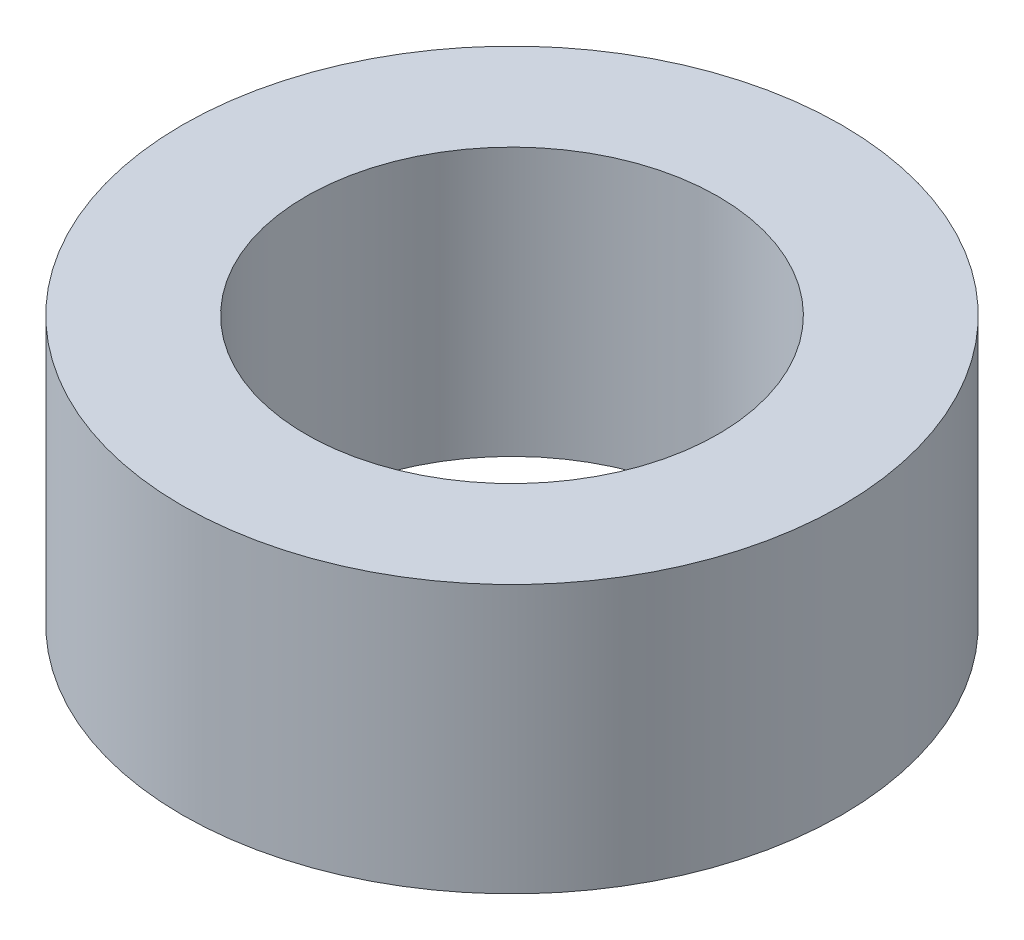
from build123d import *

# Parameters (mm, degrees)
SKETCH_1_R      = 4
SKETCH_1_R_2    = 2.5
EXTRUDE_1_DEPTH = 3.25


with BuildPart() as part:
    # 草图1 → 凸台-拉伸1 (new body)
    with BuildSketch(Plane(origin=(0, 0, 0), x_dir=(1, 0, 0), z_dir=(0, 1, 0))):
        with Locations(Location((0, 0, 0), (0, 0, 90))):
            Circle(SKETCH_1_R)
        with Locations(Location((0, 0, 0), (0, 0, 90))):
            Circle(SKETCH_1_R_2, mode=Mode.SUBTRACT)
    extrude(amount=EXTRUDE_1_DEPTH)


solid = part.part
